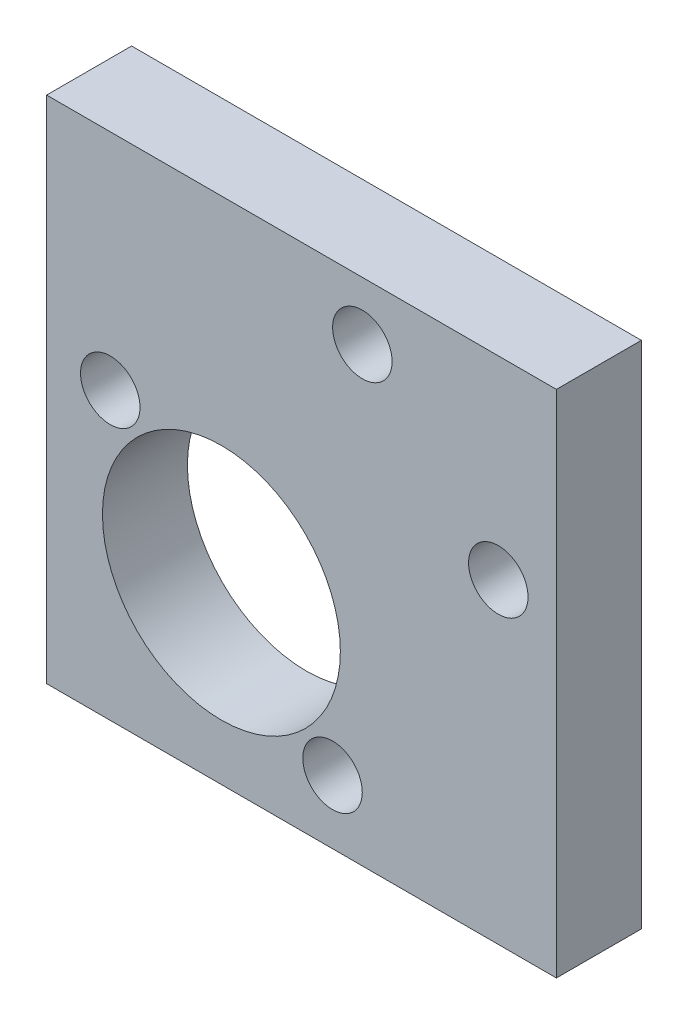
from build123d import *

# Parameters (mm, degrees)
SCHIZZO1_W                   = 30
SCHIZZO1_H                   = 30
SCHIZZO1_R                   = 1.75
SCHIZZO1_R_2                 = 7
ESTRUSIONE_ESTRUSIONE1_DEPTH = 5


with BuildPart() as part:
    # Schizzo1 → Estrusione-Estrusione1 (new body)
    with BuildSketch(Plane.XY):
        with Locations((15, 15)):
            Rectangle(SCHIZZO1_W, SCHIZZO1_H)
        with Locations((3.744262274, 16.825737726)):
            Circle(SCHIZZO1_R, mode=Mode.SUBTRACT)
        with Locations((16.825737726, 3.744262274)):
            Circle(SCHIZZO1_R, mode=Mode.SUBTRACT)
        with Locations((18.58, 26.58)):
            Circle(SCHIZZO1_R, mode=Mode.SUBTRACT)
        with Locations((26.58, 18.58)):
            Circle(SCHIZZO1_R, mode=Mode.SUBTRACT)
        with Locations((10.285, 10.285)):
            Circle(SCHIZZO1_R_2, mode=Mode.SUBTRACT)
    extrude(amount=ESTRUSIONE_ESTRUSIONE1_DEPTH)


solid = part.part
